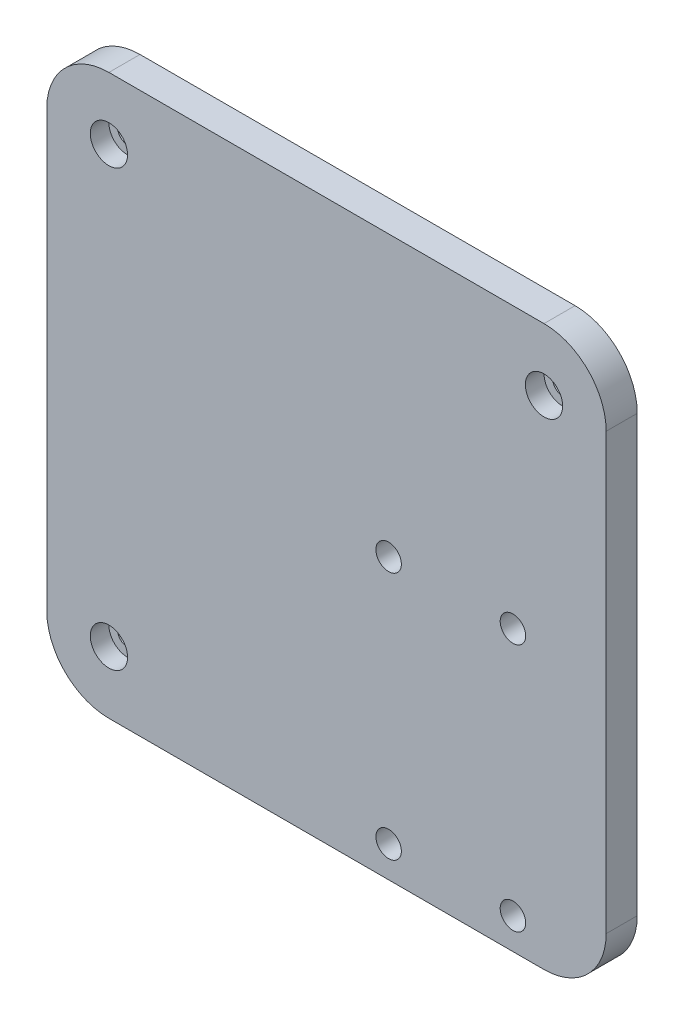
from build123d import *

# Parameters (mm, degrees)
SKETCH_1_R          = 1.6
EXTRUDE_1_DEPTH     = 5
SKETCH_2_R          = 3
CUT_EXTRUDE_1_DEPTH = 3
SKETCH_3_R          = 2.05
CUT_EXTRUDE_2_DEPTH = 64.835726674


with BuildPart() as part:
    # ｽｹｯﾁ1 → ﾎﾞｽ - 押し出し1 (new body)
    with BuildSketch(Plane.XY):
        with BuildLine():
            Line((-35, 45), (35, 45))
            ThreePointArc((35, 45), (42.071067812, 42.071067812), (45, 35))
            Line((45, 35), (45, -35))
            ThreePointArc((45, -35), (42.071067812, -42.071067812), (35, -45))
            Line((35, -45), (-35, -45))
            ThreePointArc((-35, -45), (-42.071067812, -42.071067812), (-45, -35))
            Line((-45, -35), (-45, 35))
            ThreePointArc((-45, 35), (-42.071067812, 42.071067812), (-35, 45))
        make_face()
        with Locations((-35, -35)):
            Circle(SKETCH_1_R, mode=Mode.SUBTRACT)
        with Locations((-35, 35)):
            Circle(SKETCH_1_R, mode=Mode.SUBTRACT)
        with Locations((35, 35)):
            Circle(SKETCH_1_R, mode=Mode.SUBTRACT)
    extrude(amount=EXTRUDE_1_DEPTH)

    # ｽｹｯﾁ2 → ｶｯﾄ - 押し出し1 (cut)
    with BuildSketch(Plane.XY.offset(5)):
        with Locations((-35, 35)):
            Circle(SKETCH_2_R)
        with Locations((35, 35)):
            Circle(SKETCH_2_R)
        with Locations((-35, -35)):
            Circle(SKETCH_2_R)
    extrude(amount=-CUT_EXTRUDE_1_DEPTH, mode=Mode.SUBTRACT)

    # ｽｹｯﾁ3 → ｶｯﾄ - 押し出し2 (cut, through all)
    with BuildSketch(Plane.XY.offset(5)):
        with Locations((30, 0)):
            Circle(SKETCH_3_R)
        with Locations((10, 0)):
            Circle(SKETCH_3_R)
        with Locations((10, -40)):
            Circle(SKETCH_3_R)
        with Locations((30, -40)):
            Circle(SKETCH_3_R)
    extrude(amount=-CUT_EXTRUDE_2_DEPTH, mode=Mode.SUBTRACT)


solid = part.part
